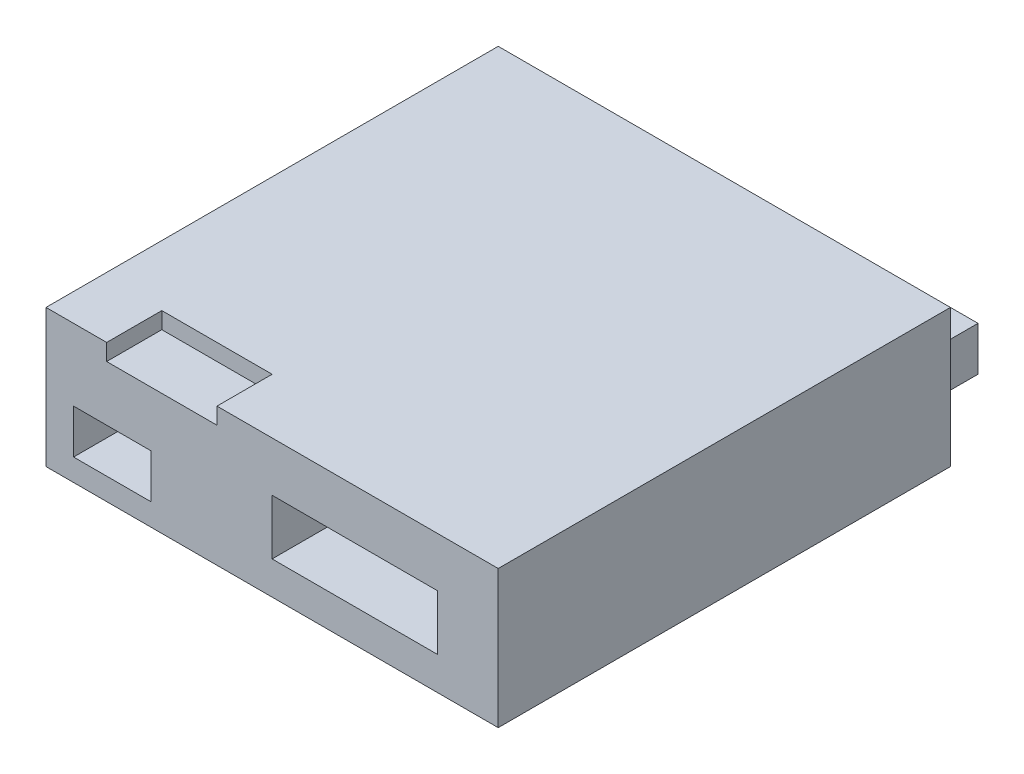
from build123d import *

# Parameters (mm, degrees)
SKETCH1_W           = 41
SKETCH1_H           = 41
BOSS_EXTRUDE1_DEPTH = 12.5
SKETCH2_W           = 10
SKETCH2_H           = 1.5
CUT_EXTRUDE1_DEPTH  = 5
SKETCH3_W           = 7
SKETCH3_H           = 4
CUT_EXTRUDE2_DEPTH  = 5
SKETCH4_W           = 15
SKETCH4_H           = 5
CUT_EXTRUDE3_DEPTH  = 5
SKETCH5_W           = 11
SKETCH5_H           = 4
BOSS_EXTRUDE2_DEPTH = 5


with BuildPart() as part:
    # Sketch1 → Boss-Extrude1 (new body)
    with BuildSketch(Plane(origin=(0, 0, 0), x_dir=(1, 0, 0), z_dir=(0, 1, 0))):
        with Locations((20.5, 20.5)):
            Rectangle(SKETCH1_W, SKETCH1_H)
    extrude(amount=BOSS_EXTRUDE1_DEPTH)

    # Sketch2 → Cut-Extrude1 (cut)
    with BuildSketch(Plane.XY):
        with Locations((10.5, 11.75)):
            Rectangle(SKETCH2_W, SKETCH2_H)
    extrude(amount=-CUT_EXTRUDE1_DEPTH, mode=Mode.SUBTRACT)

    # Sketch3 → Cut-Extrude2 (cut)
    with BuildSketch(Plane.XY):
        with Locations((6, 4)):
            Rectangle(SKETCH3_W, SKETCH3_H)
    extrude(amount=-CUT_EXTRUDE2_DEPTH, mode=Mode.SUBTRACT)

    # Sketch4 → Cut-Extrude3 (cut)
    with BuildSketch(Plane.XY):
        with Locations((28, 5.5)):
            Rectangle(SKETCH4_W, SKETCH4_H)
    extrude(amount=-CUT_EXTRUDE3_DEPTH, mode=Mode.SUBTRACT)

    # Sketch5 → Boss-Extrude2 (add)
    with BuildSketch(Plane(origin=(0, 0, -41), x_dir=(-1, 0, 0), z_dir=(0, 0, -1))):
        with Locations((-33, 5.5)):
            Rectangle(SKETCH5_W, SKETCH5_H)
    extrude(amount=BOSS_EXTRUDE2_DEPTH)


solid = part.part
